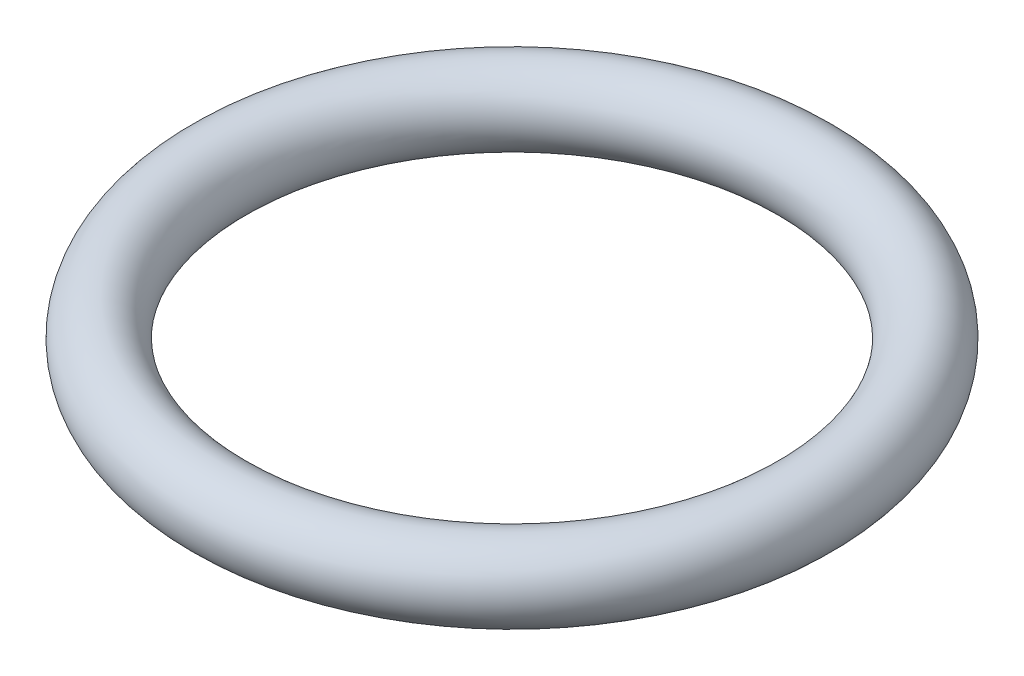
from build123d import *

# Parameters (mm, degrees)
SKETCH2_R = 1.5875


with BuildPart() as part:
    # Sketch2 → Revolve1 (revolve)
    with BuildSketch(Plane.XY, mode=Mode.PRIVATE) as revolve1_sk:
        with Locations((12.446, 0)):
            Circle(SKETCH2_R)
    revolve(revolve1_sk.sketch.rotate(Axis((0, 38.796218831, 0), (0, -1, 0)), 90), axis=Axis((0, 38.796218831, 0), (0, -1, 0)))


solid = part.part
